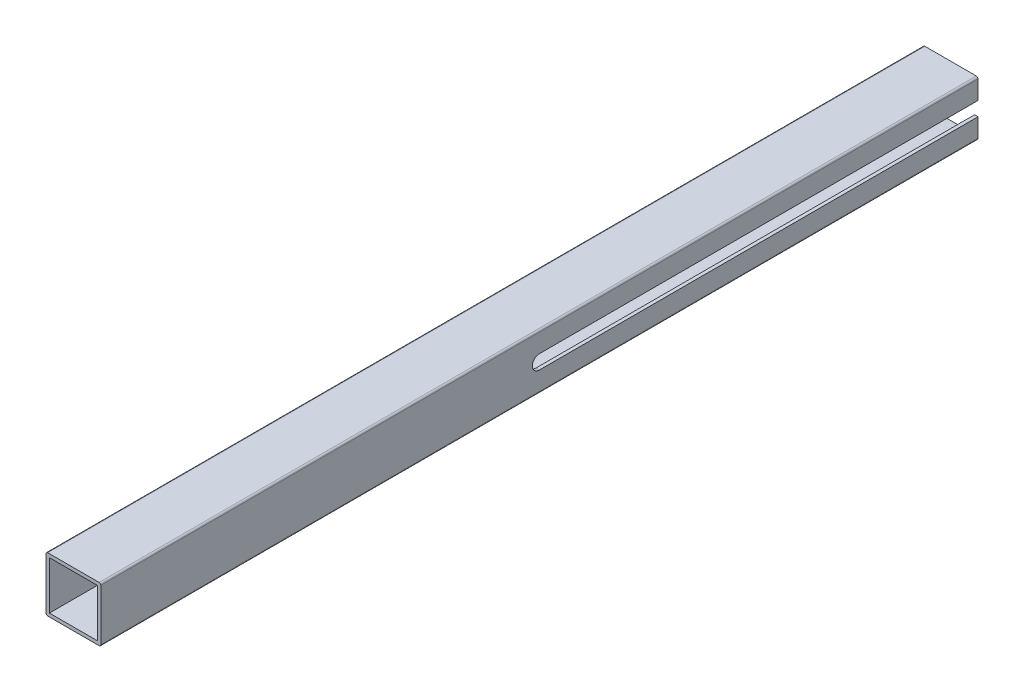
from build123d import *

# Parameters (mm, degrees)
BOSS_EXTRUDE1_DEPTH      = 203.2
BOSS_EXTRUDE1_DEPTH_BACK = 203.2
SKETCH1_W                = 25.4
SKETCH1_H                = 25.4
SKETCH1_W_2              = 22.225
SKETCH1_H_2              = 22.225
FILLET1_R                = 0.79375
CUT_EXTRUDE1_DEPTH       = 206.174779152


with BuildPart() as part:
    # Sketch1 → Boss-Extrude1 (new, two sides: drawn at the far end of the back side and taken through both)
    with BuildSketch(Plane.XY.offset(-BOSS_EXTRUDE1_DEPTH_BACK)):
        Rectangle(SKETCH1_W, SKETCH1_H)
        Rectangle(SKETCH1_W_2, SKETCH1_H_2, mode=Mode.SUBTRACT)
    extrude(amount=BOSS_EXTRUDE1_DEPTH + BOSS_EXTRUDE1_DEPTH_BACK)

    # Fillet1
    fillet1_edges = [part.edges().sort_by_distance(p)[0] for p in [
        (12.7, -12.7, 0),
        (-12.7, -12.7, 0),
        (-12.7, 12.7, 0),
        (12.7, 12.7, 0),
    ]]
    fillet(fillet1_edges, radius=FILLET1_R)

    # Sketch3 → Cut-Extrude1 (cut, through all)
    with BuildSketch(Plane(origin=(12.7, 0, 0), x_dir=(0, 0, -1), z_dir=(1, 0, 0))):
        with BuildLine():
            Line((0, 3.2639), (203.2, 3.2639))
            ThreePointArc((203.2, 3.2639), (206.4639, 0), (203.2, -3.2639))
            Line((203.2, -3.2639), (0, -3.2639))
            ThreePointArc((0, -3.2639), (-3.2639, 0), (0, 3.2639))
        make_face()
    extrude(amount=-CUT_EXTRUDE1_DEPTH, mode=Mode.SUBTRACT)


solid = part.part
